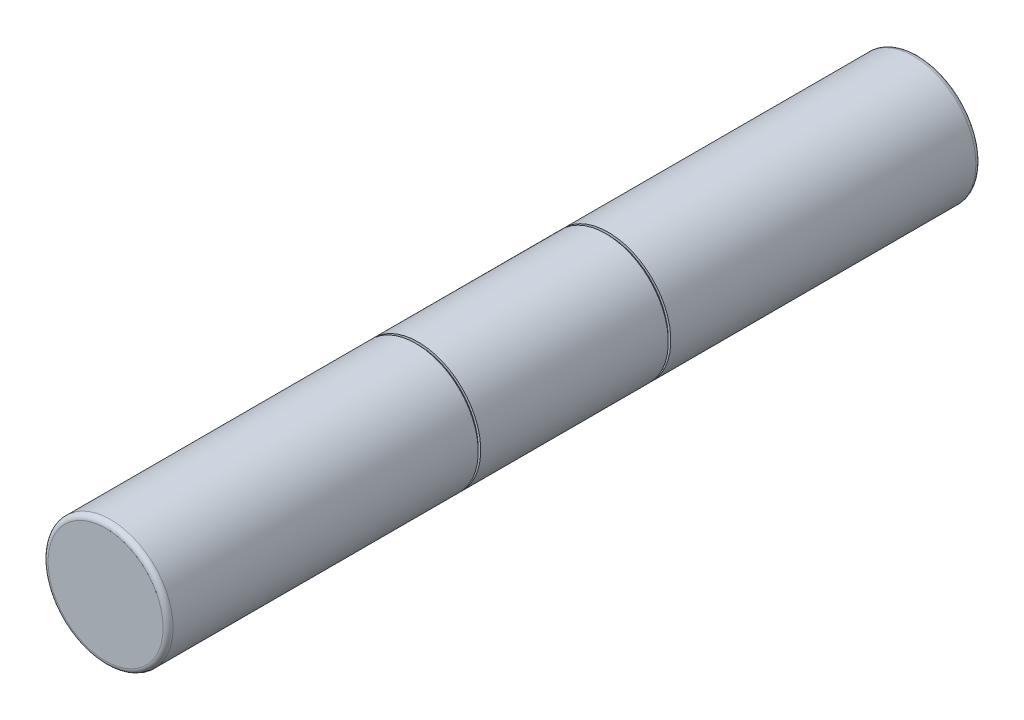
from build123d import *

# Parameters (mm, degrees)
SKETCH1_R           = 3.175
BOSS_EXTRUDE1_DEPTH = 20.6375
CUT_EXTRUDE1_START  = -0.127
SKETCH6_R           = 3.175
SKETCH6_R_2         = 3.048
CUT_EXTRUDE1_DEPTH  = 0.127
CUT_EXTRUDE2_START  = -0.127
SKETCH7_R           = 3.175
SKETCH7_R_2         = 3.048
CUT_EXTRUDE2_DEPTH  = 0.127
FILLET1_R           = 0.254


with BuildPart() as part:
    # Sketch1 → Boss-Extrude1 (new, symmetric)
    with BuildSketch(Plane.XY):
        Circle(SKETCH1_R)
    extrude(amount=BOSS_EXTRUDE1_DEPTH, both=True)

    # Sketch6 → Cut-Extrude1 (cut)
    with BuildSketch(Plane(origin=(0, 0, -4.8895), x_dir=(-1, 0, 0), z_dir=(0, 0, -1)).offset(CUT_EXTRUDE1_START)):
        Circle(SKETCH6_R)
        Circle(SKETCH6_R_2, mode=Mode.SUBTRACT)
    extrude(amount=CUT_EXTRUDE1_DEPTH, mode=Mode.SUBTRACT)

    # Sketch7 → Cut-Extrude2 (cut)
    with BuildSketch(Plane(origin=(0, 0, 4.7625), x_dir=(-1, 0, 0), z_dir=(0, 0, -1)).offset(CUT_EXTRUDE2_START)):
        Circle(SKETCH7_R)
        Circle(SKETCH7_R_2, mode=Mode.SUBTRACT)
    extrude(amount=CUT_EXTRUDE2_DEPTH, mode=Mode.SUBTRACT)

    # Fillet1
    fillet1_edges = [part.edges().sort_by_distance(p)[0] for p in [
        (-3.175, 0, -20.6375),
        (-3.175, 0, 20.6375),
    ]]
    fillet(fillet1_edges, radius=FILLET1_R)


solid = part.part
